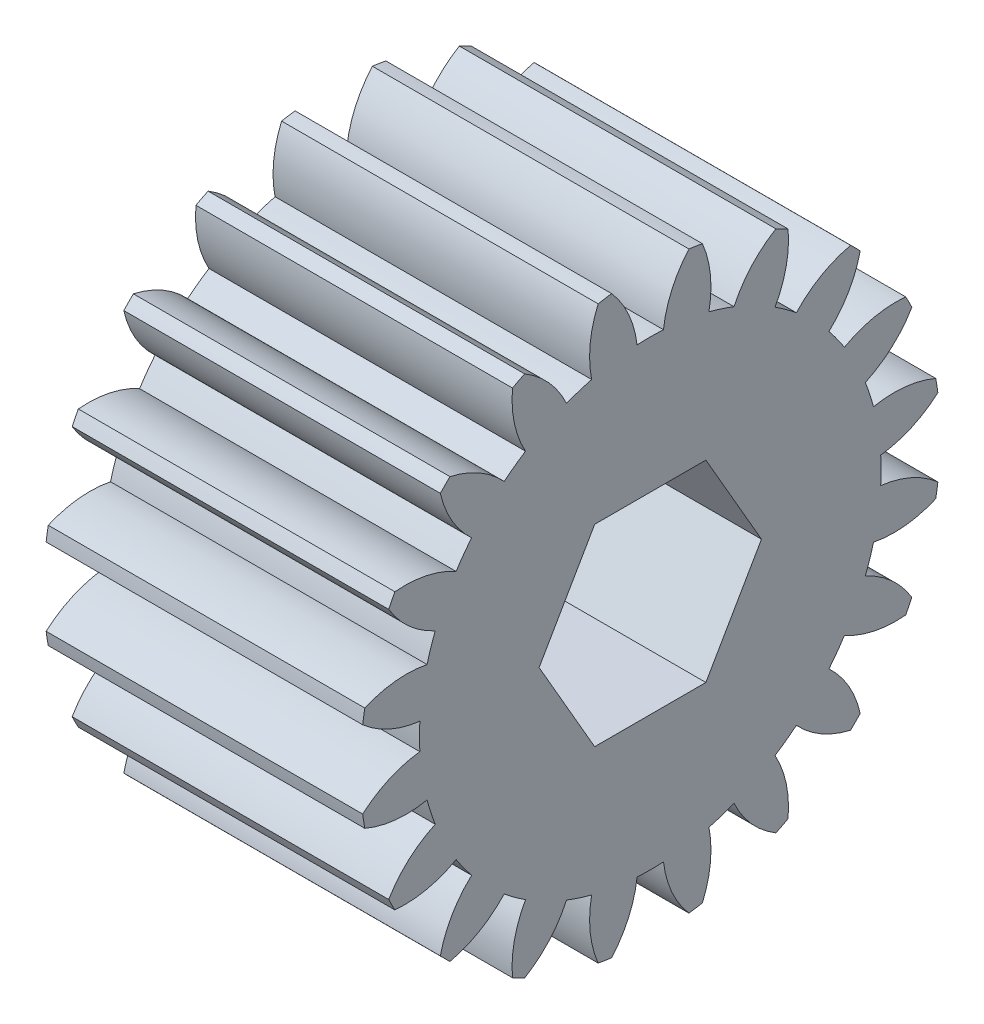
from build123d import *

# Parameters (mm, degrees)
BASPROSKE_W           = 12
BASPROSKE_H           = 11
TOOTHCUT_DEPTH        = 20.646882704
TEETHCUTS_COUNT       = 20
TEETHCUTS_ANGLE       = 342
BORSKE_R              = 0.4
BORE_DEPTH            = 50.0000508
KES_EKSTR_ZYON1_DEPTH = 20


with BuildPart() as part:
    # BasProSke → Base-Revolve (revolve)
    with BuildSketch(Plane(origin=(0, 0, 0), x_dir=(1, 0, 0), z_dir=(0, 1, 0)), mode=Mode.PRIVATE) as base_revolve_sk:
        with Locations((6, 5.5)):
            Rectangle(BASPROSKE_W, BASPROSKE_H)
    revolve(base_revolve_sk.sketch.rotate(Axis((-10, 0, 0), (1, 0, 0)), 180), axis=Axis((-10, 0, 0), (1, 0, 0)))

    # TooCutSke → ToothCut (cut, through all)
    with BuildSketch(Plane(origin=(0, 0, 0), x_dir=(0, 0, -1), z_dir=(1, 0, 0))):
        with BuildLine():
            ThreePointArc((0.499924007, 8.734705318), (0, 8.749), (-0.499924007, 8.734705318))
            ThreePointArc((-0.499924007, 8.734705318), (-0.824302243, 9.905497836), (-1.485192705, 10.924909509))
            ThreePointArc((-1.485192705, 10.924909509), (0, 11.0254), (1.485192705, 10.924909509))
            ThreePointArc((1.485192705, 10.924909509), (0.824302243, 9.905497836), (0.499924007, 8.734705318))
        make_face()
    toothcut = extrude(amount=TOOTHCUT_DEPTH, mode=Mode.SUBTRACT)

    # TeethCuts: ToothCut ×20 about axis
    teethcuts_axis = Axis((-10, 0, 0), (1, 0, 0))
    for i in range(1, TEETHCUTS_COUNT):
        add(toothcut.rotate(teethcuts_axis, i * TEETHCUTS_ANGLE / (TEETHCUTS_COUNT - 1)), mode=Mode.SUBTRACT)

    # BorSke → Bore (cut, symmetric)
    with BuildSketch(Plane(origin=(0, 0, 0), x_dir=(0, 0, -1), z_dir=(1, 0, 0))):
        with Locations(Location((0, 0, 0), (0, 0, 180))):
            Circle(BORSKE_R)
    extrude(amount=BORE_DEPTH, both=True, mode=Mode.SUBTRACT)

    # Çizim1 → Kes-Ekstrüzyon1 (cut)
    with BuildSketch(Plane(origin=(12, 0, 0), x_dir=(0, 0, -1), z_dir=(1, 0, 0))):
        Polygon((4.214656965, 0), (2.107328483, 3.65), (-2.107328483, 3.65), (-4.214656965, 0), (-2.107328483, -3.65), (2.107328483, -3.65), align=None)
    extrude(amount=-KES_EKSTR_ZYON1_DEPTH, mode=Mode.SUBTRACT)


solid = part.part
